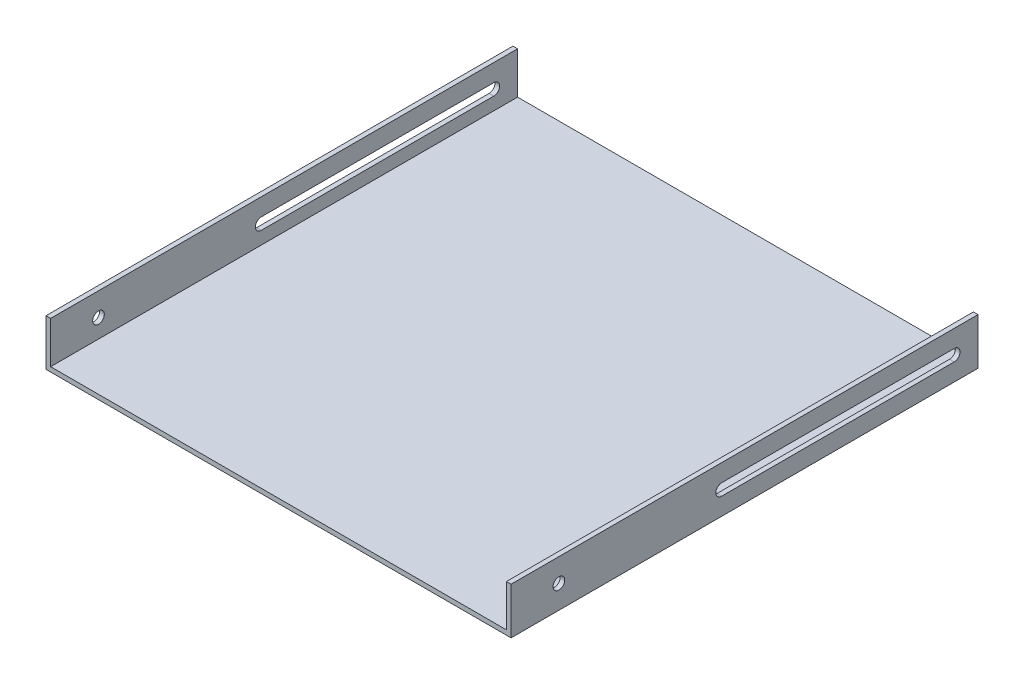
from build123d import *

# Parameters (mm, degrees)
BOSS_EXTRUDE1_DEPTH = 160
SKETCH2_R           = 2.5
CUT_EXTRUDE1_DEPTH  = 257.904651573
SKETCH3_W           = 54.938164949
SKETCH3_H           = 56.246543956
CUT_EXTRUDE2_DEPTH  = 257.904651573
SKETCH4_W           = 64.26610288
SKETCH4_H           = 38.441019891
CUT_EXTRUDE3_DEPTH  = 257.904651573


with BuildPart() as part:
    # Sketch1 → Boss-Extrude1 (new, symmetric)
    with BuildSketch(Plane.XY):
        Polygon((-98, 20), (-100, 20), (-100, 0), (100, 0), (100, 20), (98, 20), (98, 2), (-98, 2), align=None)
    extrude(amount=BOSS_EXTRUDE1_DEPTH, both=True)

    # Sketch2 → Cut-Extrude1 (cut, through all)
    with BuildSketch(Plane(origin=(100, 0, 0), x_dir=(0, 0, -1), z_dir=(1, 0, 0))):
        with Locations((-75.16, 10)):
            Circle(SKETCH2_R)
        with BuildLine():
            Line((-5.16, 12.5), (94.84, 12.5))
            ThreePointArc((94.84, 12.5), (97.34, 10), (94.84, 7.5))
            Line((94.84, 7.5), (-5.16, 7.5))
            ThreePointArc((-5.16, 7.5), (-7.66, 10), (-5.16, 12.5))
        make_face()
    extrude(amount=-CUT_EXTRUDE1_DEPTH, mode=Mode.SUBTRACT)

    # Sketch3 → Cut-Extrude2 (cut, through all)
    with BuildSketch(Plane(origin=(100, 0, 0), x_dir=(0, 0, -1), z_dir=(1, 0, 0))):
        with Locations((132.530917526, 28.123271978)):
            Rectangle(SKETCH3_W, SKETCH3_H)
    extrude(amount=-CUT_EXTRUDE2_DEPTH, mode=Mode.SUBTRACT)

    # Sketch4 → Cut-Extrude3 (cut, through all)
    with BuildSketch(Plane(origin=(100, 0, 0), x_dir=(0, 0, -1), z_dir=(1, 0, 0))):
        with Locations((-127.86694856, 19.220509946)):
            Rectangle(SKETCH4_W, SKETCH4_H)
    extrude(amount=-CUT_EXTRUDE3_DEPTH, mode=Mode.SUBTRACT)


solid = part.part
